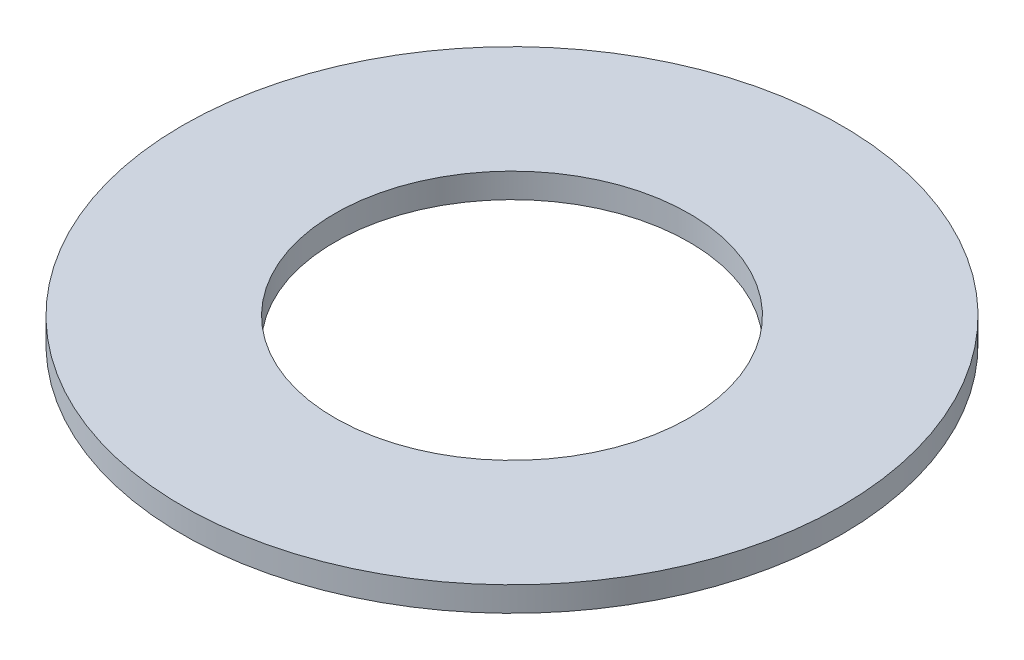
from build123d import *

# Parameters (mm, degrees)
SKETCH_1_W = 1.85
SKETCH_1_H = 0.3


with BuildPart() as part:
    # 草图1 → 旋转1 (revolve)
    with BuildSketch(Plane.XY):
        with Locations((3.075, 0.15)):
            Rectangle(SKETCH_1_W, SKETCH_1_H)
    revolve(axis=Axis((0, 0, 0), (0, 1, 0)))


solid = part.part
